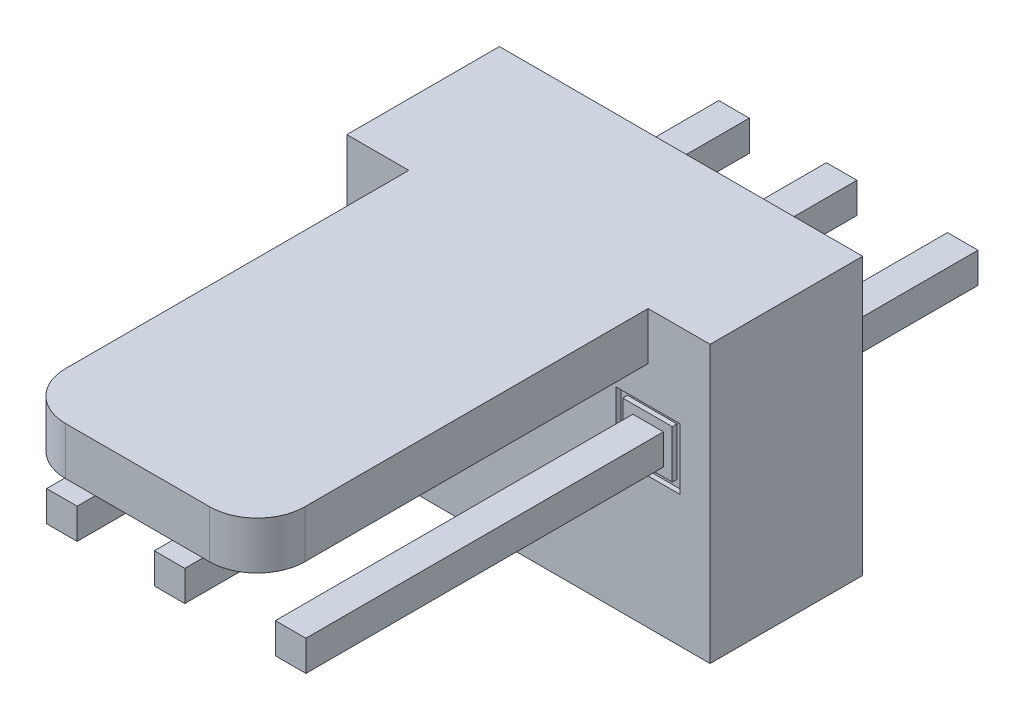
from build123d import *

# Parameters (mm, degrees)
SKETCH_2_W          = 7.62
SKETCH_2_H          = 5.8
EXTRUDE_1_DEPTH     = 3.2
SKETCH_3_W          = 5.02
SKETCH_3_H          = 1
EXTRUDE_4_DEPTH     = 8.2
FILLET_1_R          = 1
SKETCH_1_W          = 0.64
SKETCH_1_H          = 0.64
EXTRUDE_5_DEPTH     = 10.7
SKETCH_1_3_W        = 0.64
SKETCH_1_3_H        = 0.64
EXTRUDE_6_DEPTH     = 3.4
SKETCH_4_W          = 1.33797987
SKETCH_4_H          = 1.281998632
SKETCH_4_W_2        = 1.037697307
SKETCH_4_H_2        = 1.007056107
CUT_EXTRUDE_1_DEPTH = 0.1
SKETCH_5_R          = 0.155933924
CUT_EXTRUDE_2_DEPTH = 2


with BuildPart() as part:
    # Эскиз2 → Вытянуть1 (new body)
    with BuildSketch(Plane.XY):
        with Locations((-2.51, -0.5)):
            Rectangle(SKETCH_2_W, SKETCH_2_H)
    extrude(amount=EXTRUDE_1_DEPTH)

    # Эскиз3 → Вытянуть4 (add)
    with BuildSketch(Plane.XY.offset(3.2)):
        with Locations((-2.51, 1.9)):
            Rectangle(SKETCH_3_W, SKETCH_3_H)
    extrude(amount=EXTRUDE_4_DEPTH)

    # Скругление1
    fillet_1_edges = [part.edges().sort_by_distance(p)[0] for p in [
        (0, 1.9, 11.4),
        (-5.02, 1.9, 11.4),
    ]]
    fillet(fillet_1_edges, radius=FILLET_1_R)

    # Эскиз1 → Вытянуть5 (add)
    with BuildSketch(Plane.XY):
        Rectangle(SKETCH_1_W, SKETCH_1_H)
        with Locations((-2.54, 0)):
            Rectangle(SKETCH_1_W, SKETCH_1_H)
        with Locations((-4.798195283, 0)):
            Rectangle(SKETCH_1_W, SKETCH_1_H)
    extrude(amount=EXTRUDE_5_DEPTH)

    # Эскиз1<3> → Вытянуть6 (add)
    with BuildSketch(Plane.XY):
        Rectangle(SKETCH_1_3_W, SKETCH_1_3_H)
        with Locations((-2.54, 0)):
            Rectangle(SKETCH_1_3_W, SKETCH_1_3_H)
        with Locations((-4.798195283, 0)):
            Rectangle(SKETCH_1_3_W, SKETCH_1_3_H)
    extrude(amount=-EXTRUDE_6_DEPTH)

    # Эскиз4 → Вырез-Вытянуть1 (cut)
    with BuildSketch(Plane(origin=(-0.765860317, 1.721958185, 3.2), x_dir=(1, 0, 0), z_dir=(0, 0, 1))):
        with Locations((0.761284953, -1.723378162)):
            Rectangle(SKETCH_4_W, SKETCH_4_H)
        with Locations((0.75264785, -1.718405131)):
            Rectangle(SKETCH_4_W_2, SKETCH_4_H_2, mode=Mode.SUBTRACT)
    extrude(amount=-CUT_EXTRUDE_1_DEPTH, mode=Mode.SUBTRACT)

    # Эскиз5 → Вырез-Вытянуть2 (cut)
    with BuildSketch(Plane(origin=(0, 0, -3.4), x_dir=(-1, 0, 0), z_dir=(0, 0, -1))):
        with Locations((2.54, 0)):
            Circle(SKETCH_5_R)
    extrude(amount=-CUT_EXTRUDE_2_DEPTH, mode=Mode.SUBTRACT)


solid = part.part
